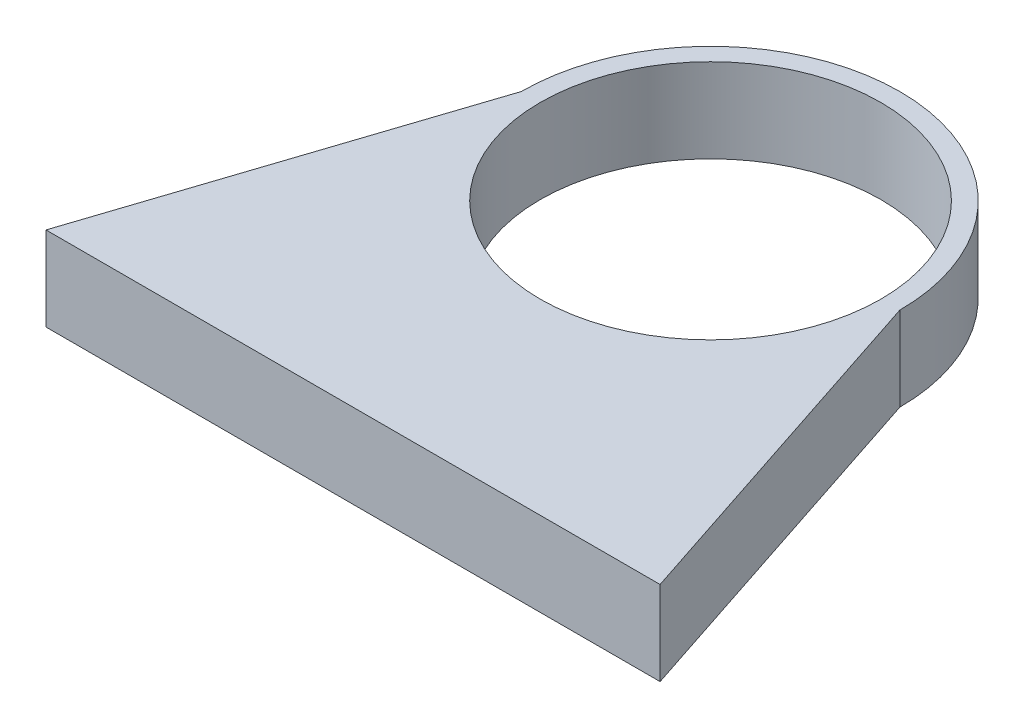
from build123d import *

# Parameters (mm, degrees)
SKETCH1_R           = 20.25
BOSS_EXTRUDE1_DEPTH = 10


with BuildPart() as part:
    # Sketch1 → Boss-Extrude1 (new body)
    with BuildSketch(Plane(origin=(0, 0, 0), x_dir=(1, 0, 0), z_dir=(0, 1, 0))):
        with BuildLine():
            Line((-36.5, -42.5), (36.5, -42.5))
            Line((36.5, -42.5), (22.5, 0))
            ThreePointArc((22.5, 0), (0, 22.5), (-22.5, 0))
            Line((-22.5, 0), (-36.5, -42.5))
        make_face()
        with Locations(Location((0, 0, 0), (0, 0, 270))):
            Circle(SKETCH1_R, mode=Mode.SUBTRACT)
    extrude(amount=BOSS_EXTRUDE1_DEPTH)


solid = part.part
